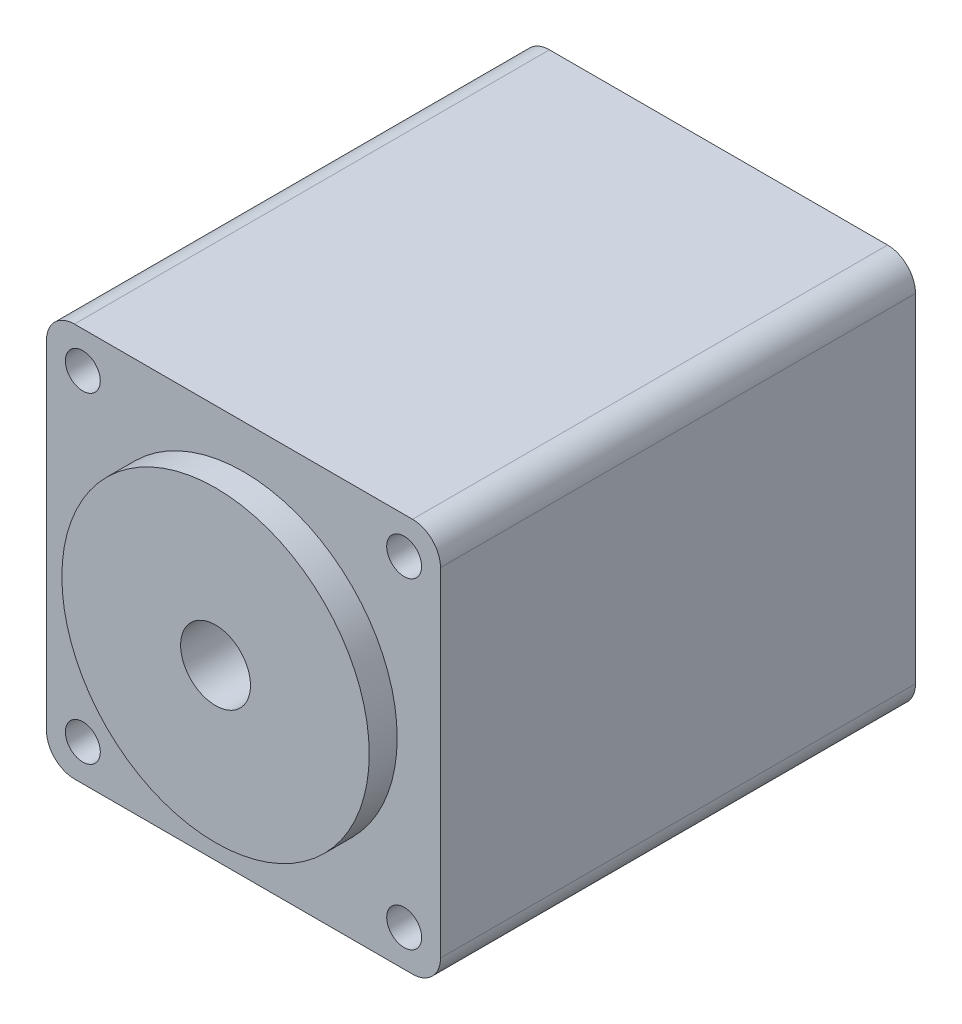
from build123d import *

# Parameters (mm, degrees)
BOSS_EXTRUDE1_DEPTH = 34
SKETCH2_R           = 11
BOSS_EXTRUDE2_DEPTH = 2
SKETCH3_R           = 2.5
CUT_EXTRUDE1_DEPTH  = 10
SKETCH4_R           = 1.25
CUT_EXTRUDE2_DEPTH  = 10


with BuildPart() as part:
    # Sketch1 → Boss-Extrude1 (new body)
    with BuildSketch(Plane.XY):
        with BuildLine():
            Line((-12.1, 14.1), (12.1, 14.1))
            ThreePointArc((12.1, 14.1), (13.514213562, 13.514213562), (14.1, 12.1))
            Line((14.1, 12.1), (14.1, -12.1))
            ThreePointArc((14.1, -12.1), (13.514213562, -13.514213562), (12.1, -14.1))
            Line((12.1, -14.1), (-12.1, -14.1))
            ThreePointArc((-12.1, -14.1), (-13.514213562, -13.514213562), (-14.1, -12.1))
            Line((-14.1, -12.1), (-14.1, 12.1))
            ThreePointArc((-14.1, 12.1), (-13.514213562, 13.514213562), (-12.1, 14.1))
        make_face()
    extrude(amount=BOSS_EXTRUDE1_DEPTH)

    # Sketch2 → Boss-Extrude2 (add)
    with BuildSketch(Plane.XY.offset(34)):
        Circle(SKETCH2_R)
    extrude(amount=BOSS_EXTRUDE2_DEPTH)

    # Sketch3 → Cut-Extrude1 (cut)
    with BuildSketch(Plane.XY.offset(36)):
        Circle(SKETCH3_R)
    extrude(amount=-CUT_EXTRUDE1_DEPTH, mode=Mode.SUBTRACT)

    # Sketch4 → Cut-Extrude2 (cut)
    with BuildSketch(Plane.XY.offset(34)):
        with Locations((-11.5, 11.5)):
            Circle(SKETCH4_R)
        with Locations((11.5, 11.5)):
            Circle(SKETCH4_R)
        with Locations(Location((11.5, -11.5, 0), (0, 0, 180))):
            Circle(SKETCH4_R)
        with Locations(Location((-11.5, -11.5, 0), (0, 0, 180))):
            Circle(SKETCH4_R)
    extrude(amount=-CUT_EXTRUDE2_DEPTH, mode=Mode.SUBTRACT)


solid = part.part
